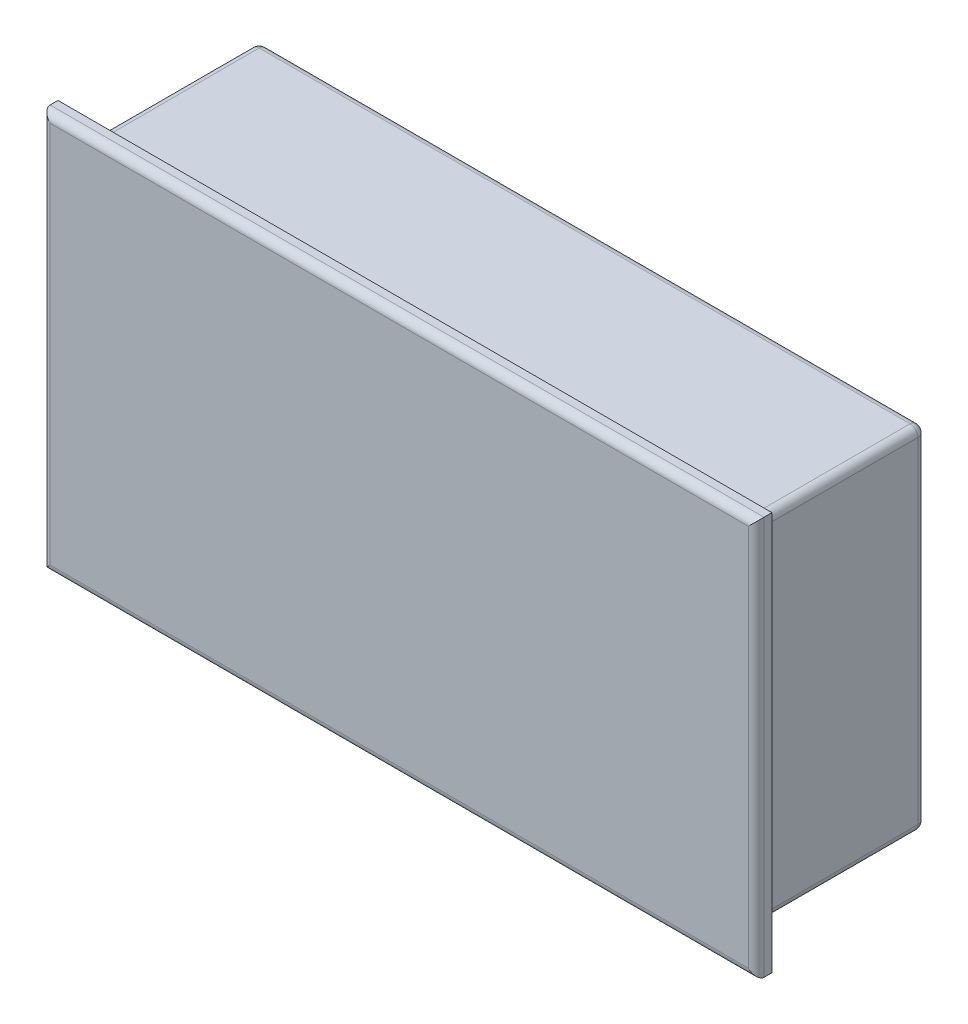
from build123d import *

# Parameters (mm, degrees)
SKETCH1_W           = 84.5
SKETCH1_H           = 44.5
BOSS_EXTRUDE1_DEPTH = 22.5
SKETCH2_W           = 90.5
SKETCH2_H           = 50.5
BOSS_EXTRUDE2_DEPTH = 2
FILLET1_R           = 1


with BuildPart() as part:
    # Sketch1 → Boss-Extrude1 (new body)
    with BuildSketch(Plane.XY):
        Rectangle(SKETCH1_W, SKETCH1_H)
    extrude(amount=-BOSS_EXTRUDE1_DEPTH)

    # Sketch2 → Boss-Extrude2 (add)
    with BuildSketch(Plane.XY):
        Rectangle(SKETCH2_W, SKETCH2_H)
    extrude(amount=BOSS_EXTRUDE2_DEPTH)

    # Fillet1
    fillet1_edges = [part.edges().sort_by_distance(p)[0] for p in [
        (-42.25, 0, -22.5),
        (-45.25, 0, 2),
        (0, -25.25, 2),
        (45.25, 0, 2),
        (0, 25.25, 2),
        (0, -22.25, -22.5),
        (42.25, 0, -22.5),
        (42.25, -22.25, -11.25),
        (-42.25, -22.25, -11.25),
        (-42.25, 22.25, -11.25),
        (42.25, 22.25, -11.25),
        (0, 22.25, -22.5),
    ]]
    fillet(fillet1_edges, radius=FILLET1_R)


solid = part.part
